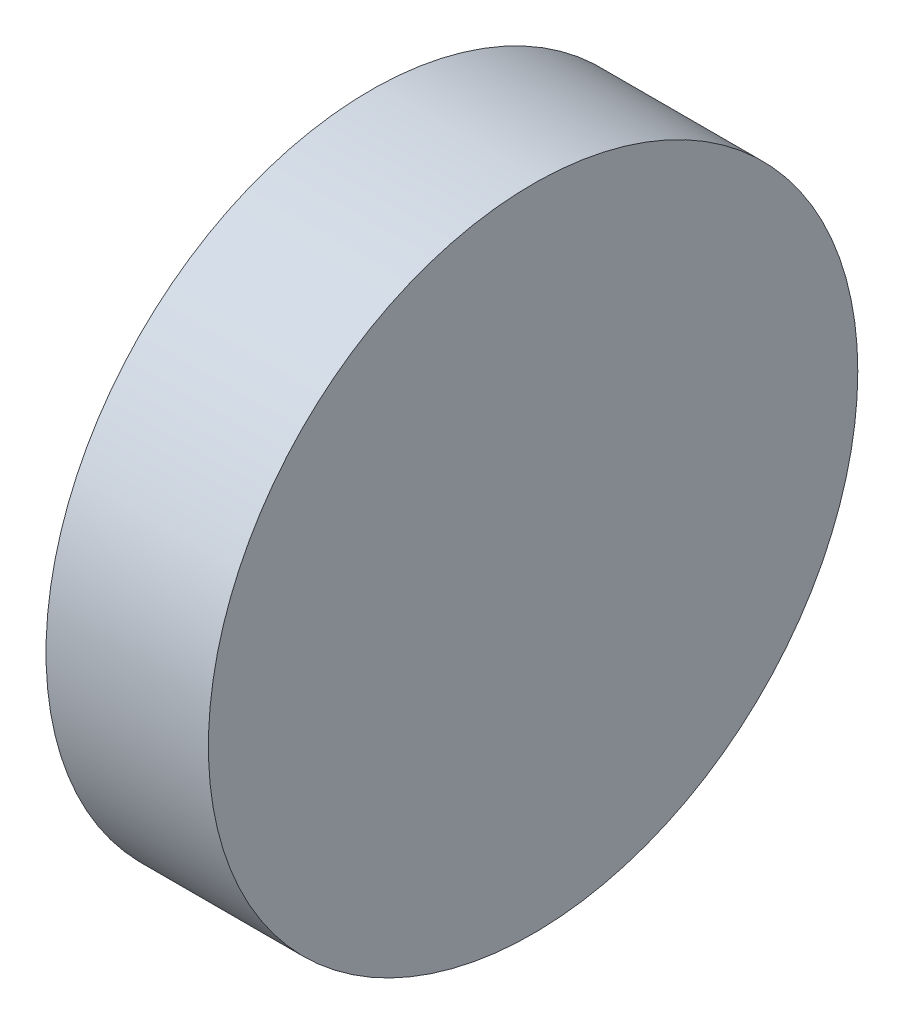
from build123d import *

# Parameters (mm, degrees)
SKETCH1_R                       = 20
BOSS_EXTRUDE1_DEPTH             = 10
M2X0_4_TAPPED_HOLE1_D           = 1.6
M2X0_4_TAPPED_HOLE1_DEPTH       = 5.2
M2X0_4_TAPPED_HOLE1_CSINK_D     = 2.05
M2X0_4_TAPPED_HOLE1_CSINK_ANGLE = 90
M2X0_4_TAPPED_HOLE1_TIP         = 0.480688495


with BuildPart() as part:
    # Sketch1 → Boss-Extrude1 (new body)
    with BuildSketch(Plane(origin=(0, 0, 0), x_dir=(0, 0, -1), z_dir=(1, 0, 0))):
        Circle(SKETCH1_R)
    extrude(amount=BOSS_EXTRUDE1_DEPTH)

    # M2x0.4 Tapped Hole1
    with Locations(Plane.ZY):
        with Locations((0, -5)):
            CounterSinkHole(M2X0_4_TAPPED_HOLE1_D / 2, M2X0_4_TAPPED_HOLE1_CSINK_D / 2, depth=M2X0_4_TAPPED_HOLE1_DEPTH, counter_sink_angle=M2X0_4_TAPPED_HOLE1_CSINK_ANGLE)
            with Locations((0, 0, -(M2X0_4_TAPPED_HOLE1_DEPTH + M2X0_4_TAPPED_HOLE1_TIP / 2))):  # 118° drill point
                Cone(0, M2X0_4_TAPPED_HOLE1_D / 2, M2X0_4_TAPPED_HOLE1_TIP, mode=Mode.SUBTRACT)


solid = part.part
